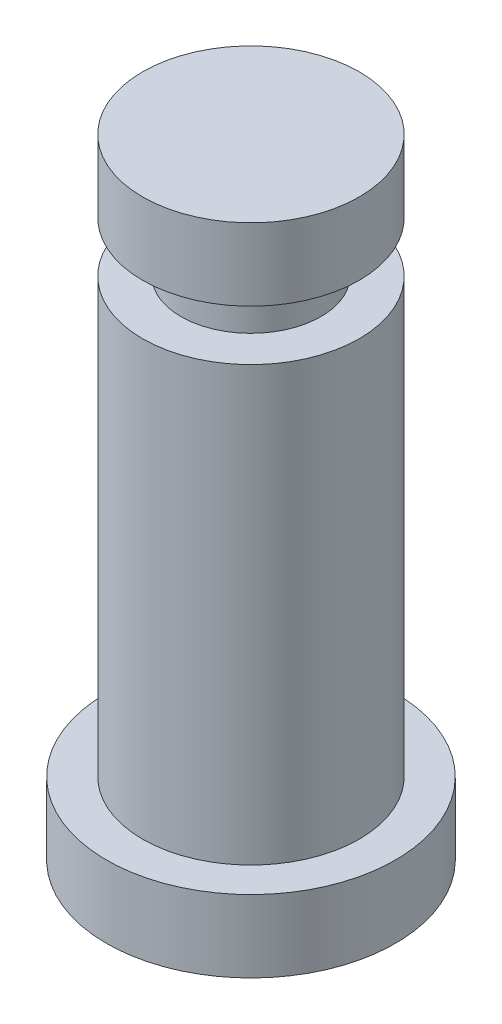
from build123d import *

# Parameters (mm, degrees)
SKETCH2_W = 2.65
SKETCH2_H = 3.5


with BuildPart() as part:
    # Sketch1 → Revolve1 (revolve)
    with BuildSketch(Plane.XY, mode=Mode.PRIVATE) as revolve1_sk:
        Polygon((0, 0), (10, 0), (10, 5), (7.5, 5), (7.5, 43.5), (0, 43.5), align=None)
    revolve(revolve1_sk.sketch.rotate(Axis((0, 48.5, 0), (0, -1, 0)), 180), axis=Axis((0, 48.5, 0), (0, -1, 0)))

    # Sketch2 → Cut-Revolve1 (revolve, cut)
    with BuildSketch(Plane.XY, mode=Mode.PRIVATE) as cut_revolve1_sk:
        with Locations((6.175, 36.75)):
            Rectangle(SKETCH2_W, SKETCH2_H)
    revolve(cut_revolve1_sk.sketch.rotate(Axis((0, 43.5, 0), (0, -1, 0)), 180), axis=Axis((0, 43.5, 0), (0, -1, 0)), mode=Mode.SUBTRACT)


solid = part.part
